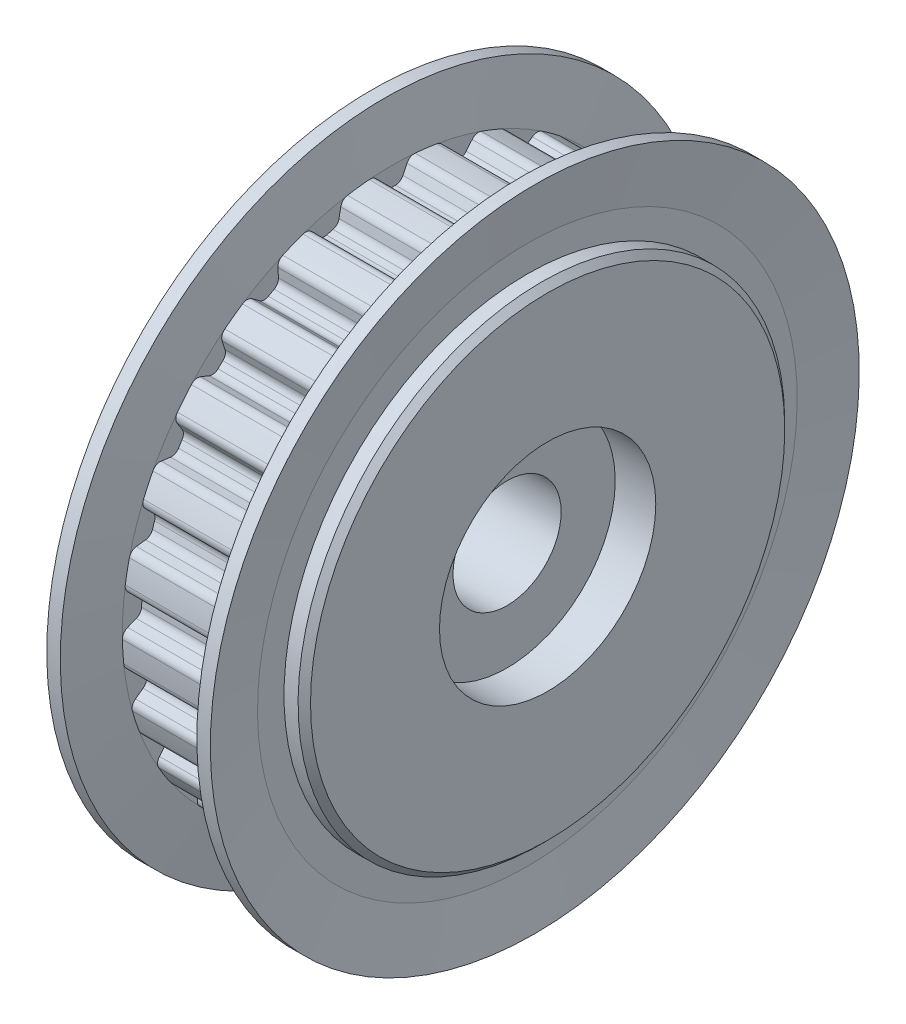
from build123d import *

# Parameters (mm, degrees)
CUT_EXTRUDE_START        = 11.5
CUT_EXTRUDE_1_DEPTH      = 9
PATTERN_CIRCULAR_1_COUNT = 25
SKETCH_6_R               = 4
CUT_EXTRUDE_2_DEPTH      = 37.715119501
CHAMFER_1_SIZE           = 0.18
SKETCH_10_W              = 3
SKETCH_10_H              = 8


with BuildPart() as part:
    # 草图3 → 旋转1 (revolve)
    with BuildSketch(Plane.XY):
        Polygon((0, 0), (0, 17.54), (0.46, 18), (2.5, 18), (2.5, 19.96), (11.5, 19.96), (11.5, 18), (13.54, 18), (14, 17.54), (14, 0), align=None)
    revolve(axis=Axis((14, 0, 0), (-1, 0, 0)))

    # 草图4 → Cut-Extrude 1 (cut)
    with BuildSketch(Plane(origin=(0, 0, 0), x_dir=(0, 0, -1), z_dir=(1, 0, 0)).offset(CUT_EXTRUDE_START)):
        with BuildLine():
            Line((-0.246387141, 18.56), (0.246387141, 18.56))
            ThreePointArc((0.246387141, 18.56), (0.574139902, 18.655531218), (0.799234891, 18.91220286))
            Line((0.799234891, 18.91220286), (1.090977728, 19.537847394))
            ThreePointArc((1.090977728, 19.537847394), (1.338241464, 19.807988139), (1.695646333, 19.88784512))
            ThreePointArc((1.695646333, 19.88784512), (0, 19.96), (-1.695646333, 19.88784512))
            ThreePointArc((-1.695646333, 19.88784512), (-1.338241464, 19.807988139), (-1.090977728, 19.537847394))
            Line((-1.090977728, 19.537847394), (-0.799234891, 18.91220286))
            ThreePointArc((-0.799234891, 18.91220286), (-0.574139902, 18.655531218), (-0.246387141, 18.56))
        make_face()
    cut_extrude_1 = extrude(amount=-CUT_EXTRUDE_1_DEPTH, mode=Mode.SUBTRACT)

    # 阵列(圆周)1: Cut-Extrude 1 ×25 about axis
    pattern_circular_1_axis = Axis((0, 0, 0), (1, 0, 0))
    for i in range(1, PATTERN_CIRCULAR_1_COUNT):
        add(cut_extrude_1.rotate(pattern_circular_1_axis, i * 360 / PATTERN_CIRCULAR_1_COUNT), mode=Mode.SUBTRACT)

    # 草图5 → 旋转2 (revolve)
    with BuildSketch(Plane.XY, mode=Mode.PRIVATE) as revolve_2_sk:
        Polygon((1.95, 24), (2.5, 19.96), (2.5, 18), (1.5, 18), (1.5, 19.96), (0.95, 24), align=None)
        Polygon((12.5, 18), (11.5, 18), (11.5, 19.96), (12.05, 24), (13.05, 24), (12.5, 19.96), align=None)
    revolve(revolve_2_sk.sketch.rotate(Axis((0, 0, 0), (1, 0, 0)), 180), axis=Axis((0, 0, 0), (1, 0, 0)))

    # 草图6 → 切除-拉伸2 (cut, through all)
    with BuildSketch(Plane(origin=(0, 0, 0), x_dir=(0, 0, -1), z_dir=(1, 0, 0))):
        Circle(SKETCH_6_R)
    extrude(amount=CUT_EXTRUDE_2_DEPTH, mode=Mode.SUBTRACT)

    # 倒角1
    chamfer_1_edges = [part.edges().sort_by_distance(p)[0] for p in [
        (0, 0, 4),
        (14, 0, 4),
    ]]
    chamfer(chamfer_1_edges, length=CHAMFER_1_SIZE)

    # 草图10 → Cut-Revolve 9736 (revolve, cut)
    with BuildSketch(Plane.XY, mode=Mode.PRIVATE) as cut_revolve_9736_sk:
        with Locations((12.5, 4)):
            Rectangle(SKETCH_10_W, SKETCH_10_H)
        with Locations((1.5, 4)):
            Rectangle(SKETCH_10_W, SKETCH_10_H)
    revolve(cut_revolve_9736_sk.sketch.rotate(Axis((0, 0, 0), (1, 0, 0)), 90), axis=Axis((0, 0, 0), (1, 0, 0)), mode=Mode.SUBTRACT)


solid = part.part
